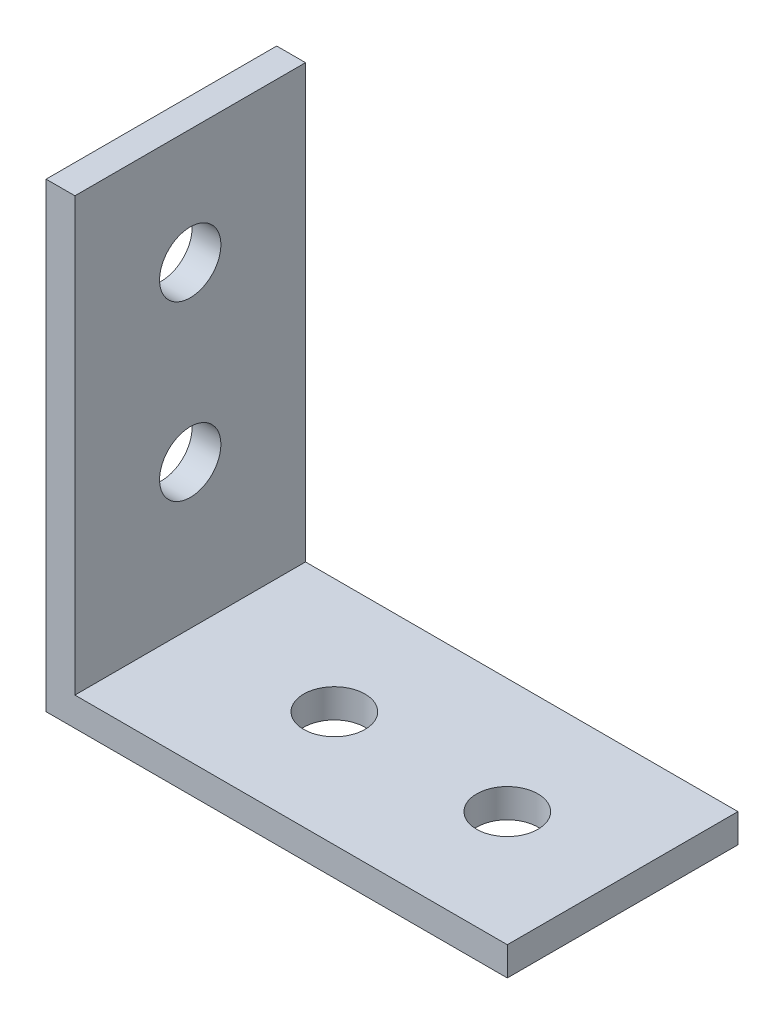
from build123d import *

# Parameters (mm, degrees)
BOSS_EXTRUDE1_DEPTH     = 25.4
F_1_4_CLEARANCE_HOLE1_D = 6.7564
F_1_4_CLEARANCE_HOLE2_D = 6.7564


with BuildPart() as part:
    # Sketch1 → Boss-Extrude1 (new body)
    with BuildSketch(Plane.XY):
        Polygon((0, 0), (0, -50.8), (50.8, -50.8), (50.8, -47.625), (3.175, -47.625), (3.175, 0), align=None)
    extrude(amount=BOSS_EXTRUDE1_DEPTH)

    # 1/4 Clearance Hole1 (through all)
    with Locations(Plane(origin=(0, -47.625, 0), x_dir=(1, 0, 0), z_dir=(0, 1, 0))):
        with Locations((38.1, -12.7), (19.05, -12.7)):
            Hole(F_1_4_CLEARANCE_HOLE1_D / 2)

    # 1/4 Clearance Hole2 (through all)
    with Locations(Plane(origin=(3.175, 0, 0), x_dir=(0, 0, -1), z_dir=(1, 0, 0))):
        with Locations((-12.7, -12.7), (-12.7, -31.75)):
            Hole(F_1_4_CLEARANCE_HOLE2_D / 2)


solid = part.part
